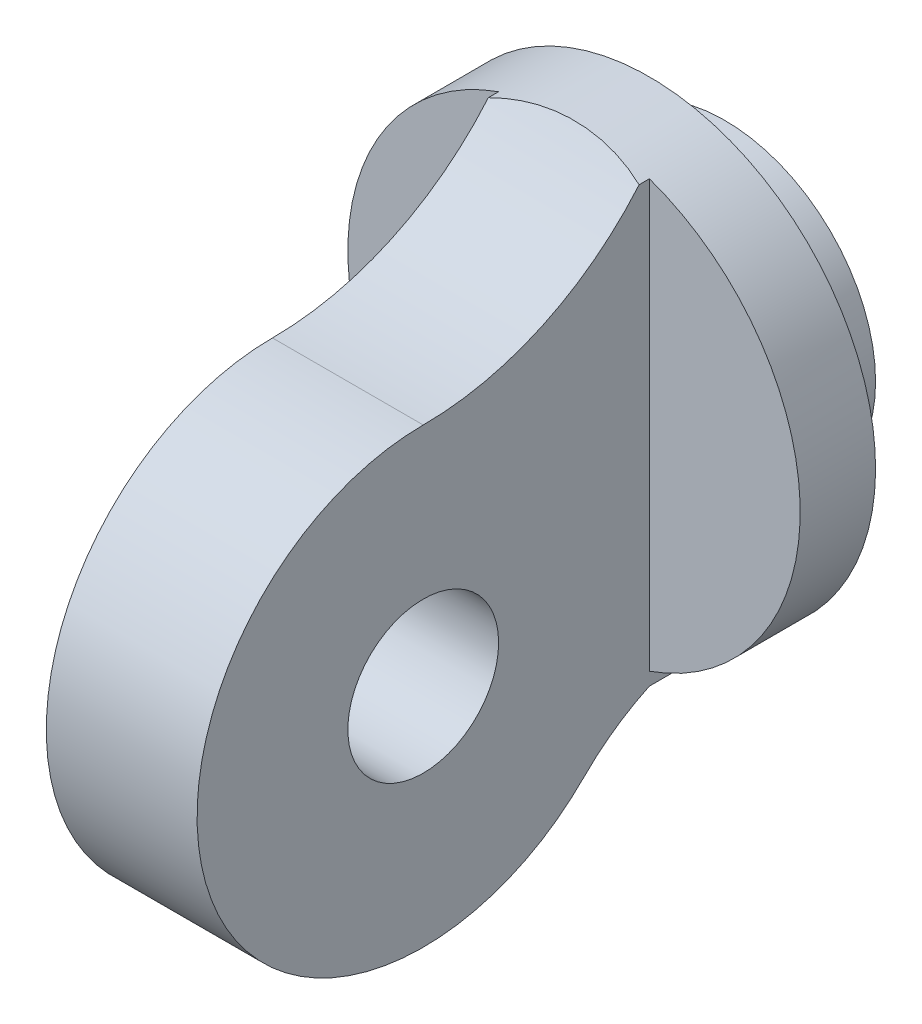
from build123d import *

# Parameters (mm, degrees)
SKETCH1_R                = 500
BOSS_EXTRUDE1_DEPTH      = 250
SKETCH3_R                = 125
CUT_EXTRUDE1_DEPTH       = 100
SKETCH4_R                = 750
BOSS_EXTRUDE2_DEPTH      = 250
SKETCH5_R                = 250
BOSS_EXTRUDE4_DEPTH      = 250
CUT_EXTRUDE2_DEPTH       = 500
CUT_EXTRUDE5_DEPTH       = 500
BOSS_EXTRUDE5_START      = 250
BOSS_EXTRUDE5_DEPTH      = 250
BOSS_EXTRUDE6_START      = 250
BOSS_EXTRUDE6_DEPTH      = 250
BOSS_EXTRUDE7_REACH      = 2213.476
BOSS_EXTRUDE7_END_RADIUS = 750


with BuildPart() as part:
    # Sketch1 → Boss-Extrude1 (new body)
    with BuildSketch(Plane.XY):
        Circle(SKETCH1_R)
    extrude(amount=BOSS_EXTRUDE1_DEPTH)

    # Sketch3 → Cut-Extrude1 (cut)
    with BuildSketch(Plane(origin=(0, 0, 0), x_dir=(-1, 0, 0), z_dir=(0, 0, -1))):
        Circle(SKETCH3_R)
    extrude(amount=-CUT_EXTRUDE1_DEPTH, mode=Mode.SUBTRACT)

    # Sketch4 → Boss-Extrude2 (add)
    with BuildSketch(Plane.XY.offset(250)):
        Circle(SKETCH4_R)
    extrude(amount=BOSS_EXTRUDE2_DEPTH)

    # Sketch5 → Boss-Extrude4 (add, symmetric)
    with BuildSketch(Plane(origin=(0, 0, 0), x_dir=(0, 0, -1), z_dir=(1, 0, 0))):
        with BuildLine():
            Line((-500, 750), (-500, -750))
            ThreePointArc((-500, -750), (-615.24272839, -816.608980403), (-716.895581803, -902.541163606))
            ThreePointArc((-716.895581803, -902.541163606), (-1942.154561028, -663.82877912), (-1250, 375))
            ThreePointArc((-1250, 375), (-830.737254219, 473.974508438), (-500, 750))
        make_face()
        with Locations((-1250, -375)):
            Circle(SKETCH5_R, mode=Mode.SUBTRACT)
    extrude(amount=BOSS_EXTRUDE4_DEPTH, both=True)

    # Sketch8 → Cut-Extrude2 (cut)
    with BuildSketch(Plane(origin=(0, 0, 500), x_dir=(-1, 0, 0), z_dir=(0, 0, -1))):
        with BuildLine():
            Line((-250, 750), (-250, 707.106781187))
            ThreePointArc((-250, 707.106781187), (-126.826484044, 739.19891974), (0, 750))
            Line((0, 750), (-250, 750))
        make_face()
    extrude(amount=-CUT_EXTRUDE2_DEPTH, mode=Mode.SUBTRACT)

    # Sketch10 → Cut-Extrude5 (cut)
    with BuildSketch(Plane(origin=(0, 0, 500), x_dir=(-1, 0, 0), z_dir=(0, 0, -1))):
        with BuildLine():
            Line((250, 750), (0, 750))
            ThreePointArc((0, 750), (126.826484044, 739.19891974), (250, 707.106781187))
            Line((250, 707.106781187), (250, 750))
        make_face()
    extrude(amount=-CUT_EXTRUDE5_DEPTH, mode=Mode.SUBTRACT)

    # Sketch11 → Boss-Extrude5 (add)
    with BuildSketch(Plane(origin=(0, 0, 500), x_dir=(-1, 0, 0), z_dir=(0, 0, -1)).offset(BOSS_EXTRUDE5_START)):
        with BuildLine():
            Line((250, -750), (250, -707.106781187))
            ThreePointArc((250, -707.106781187), (126.826484044, -739.19891974), (0, -750))
            Line((0, -750), (250, -750))
        make_face()
    extrude(amount=-BOSS_EXTRUDE5_DEPTH)

    # Sketch12 → Boss-Extrude6 (add)
    with BuildSketch(Plane(origin=(0, 0, 500), x_dir=(-1, 0, 0), z_dir=(0, 0, -1)).offset(BOSS_EXTRUDE6_START)):
        with BuildLine():
            Line((-250, -750), (0, -750))
            ThreePointArc((0, -750), (-126.826484044, -739.19891974), (-250, -707.106781187))
            Line((-250, -707.106781187), (-250, -750))
        make_face()
    extrude(amount=-BOSS_EXTRUDE6_DEPTH)

    # Boss-Extrude7: up to this cylinder (the profile starts inside it)
    boss_extrude7_end = Plane(origin=(0, -1430.082327212, 183.791163606), z_dir=(-1, 0, 0)) * Cylinder(BOSS_EXTRUDE7_END_RADIUS, 5927.952, mode=Mode.PRIVATE)
    # Sketch15 → Boss-Extrude7 (add, up to the surface)
    with BuildSketch(Plane(origin=(0, 0, 250), x_dir=(-1, 0, 0), z_dir=(0, 0, -1)), mode=Mode.PRIVATE) as boss_extrude7_sk1:
        with BuildLine():
            Line((250, -750), (-250, -750))
            ThreePointArc((-250, -750), (0, -790.569415042), (250, -750))
        make_face()
    boss_extrude7_tool1 = extrude(boss_extrude7_sk1.sketch, amount=-BOSS_EXTRUDE7_REACH, mode=Mode.PRIVATE) & boss_extrude7_end
    add(boss_extrude7_tool1.solids().sort_by_distance((0, -766.263993, 250))[0])


solid = part.part
